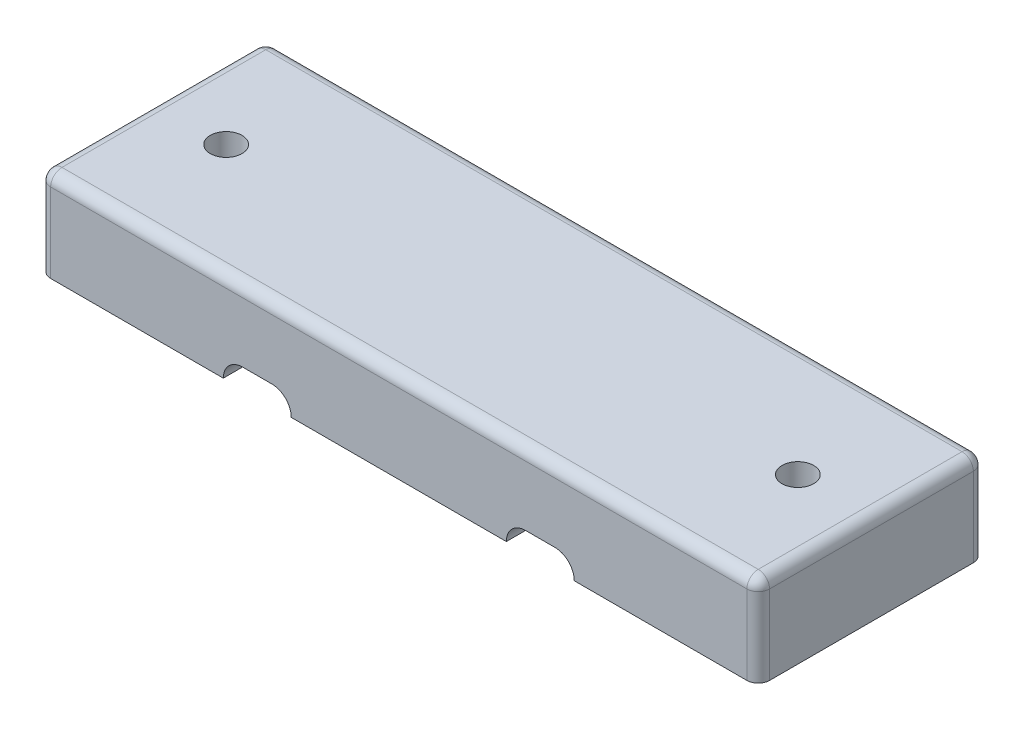
from build123d import *

# Parameters (mm, degrees)
SKETCH1_W            = 63.5
SKETCH1_H            = 20
SKETCH1_R            = 1.4
BASE_DEPTH           = 8
WIRE_GROOVES_DEPTH   = 39.833780398
F_1MM_EDGE_FILLETS_R = 1


with BuildPart() as part:
    # Sketch1 → Base (new body)
    with BuildSketch(Plane(origin=(0, 0, 0), x_dir=(1, 0, 0), z_dir=(0, 1, 0))):
        Rectangle(SKETCH1_W, SKETCH1_H)
        with Locations((-25.25, 0)):
            Circle(SKETCH1_R, mode=Mode.SUBTRACT)
        with Locations((25.25, 0)):
            Circle(SKETCH1_R, mode=Mode.SUBTRACT)
    extrude(amount=BASE_DEPTH)

    # Sketch2 → Wire Grooves (cut, through all)
    with BuildSketch(Plane(origin=(0, 10, -10), x_dir=(1, 0, 0), z_dir=(0, 0, -1))):
        with BuildLine():
            Line((-15.5, 10), (-9.5, 10))
            ThreePointArc((-9.5, 10), (-9.997918472, 8.797918472), (-11.2, 8.3))
            Line((-11.2, 8.3), (-13.8, 8.3))
            ThreePointArc((-13.8, 8.3), (-15.002081528, 8.797918472), (-15.5, 10))
        make_face()
        with BuildLine():
            Line((9.5, 10), (15.5, 10))
            ThreePointArc((15.5, 10), (15.002081528, 8.797918472), (13.8, 8.3))
            Line((13.8, 8.3), (11.2, 8.3))
            ThreePointArc((11.2, 8.3), (9.997918472, 8.797918472), (9.5, 10))
        make_face()
    extrude(amount=-WIRE_GROOVES_DEPTH, mode=Mode.SUBTRACT)

    # 1mm Edge Fillets
    f_1mm_edge_fillets_edges = [part.edges().sort_by_distance(p)[0] for p in [
        (-31.75, 4, -10),
        (0, 8, -10),
        (31.75, 4, -10),
        (31.75, 4, 10),
        (31.75, 8, 0),
        (-31.75, 8, 0),
        (0, 8, 10),
        (-31.75, 4, 10),
    ]]
    fillet(f_1mm_edge_fillets_edges, radius=F_1MM_EDGE_FILLETS_R)


solid = part.part
